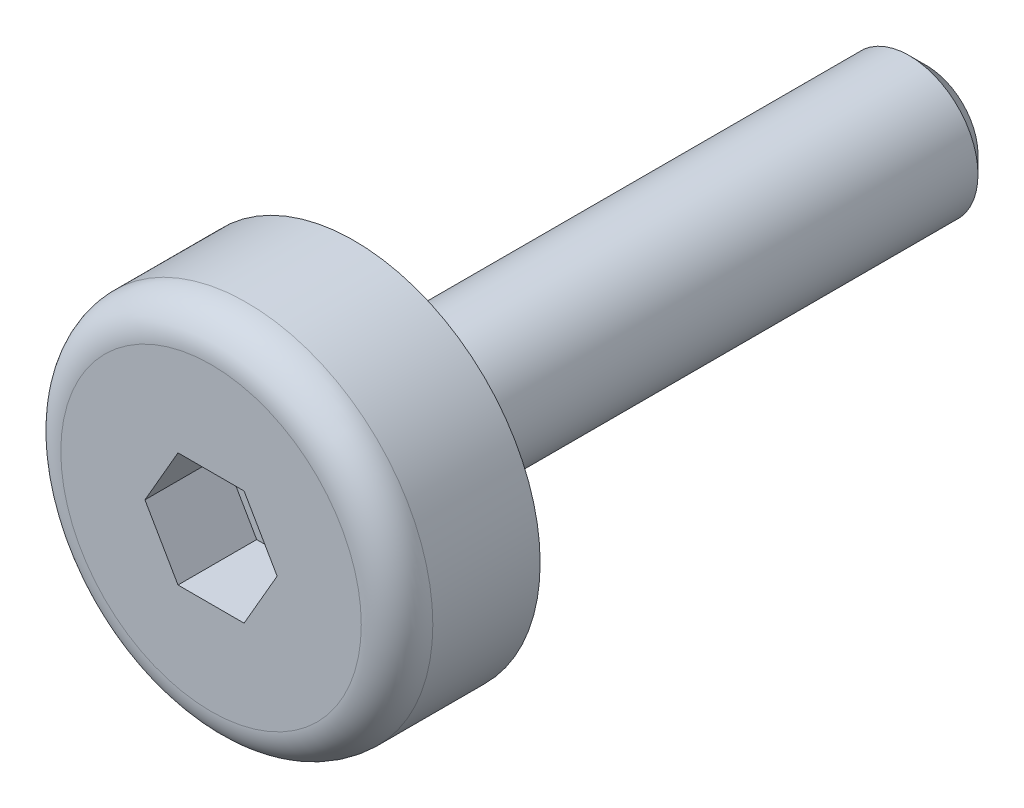
from build123d import *

# Parameters (mm, degrees)
SHANK_TIP_CHAMFER_SIZE = 0.3
PAN_HEAD_ROUND_R       = 0.625
HEX_DRIVE_CUT_DEPTH    = 1.375


with BuildPart() as part:
    # Screw Section → Screw Blank Revolve (revolve)
    with BuildSketch(Plane(origin=(0, 0, 0), x_dir=(1, 0, 0), z_dir=(0, 1, 0))):
        Polygon((0, 10), (1.2, 10), (1.2, 0), (3.25, 0), (3.25, -2.5), (0, -2.5), align=None)
    revolve(axis=Axis((0, 0, 10.123), (0, 0, -1)))

    # Shank Tip Chamfer
    shank_tip_chamfer_edges = [part.edges().sort_by_distance(p)[0] for p in [
        (-1.2, 0, -10),
    ]]
    chamfer(shank_tip_chamfer_edges, length=SHANK_TIP_CHAMFER_SIZE)

    # Pan Head Round
    pan_head_round_edges = [part.edges().sort_by_distance(p)[0] for p in [
        (-3.25, 0, 2.5),
    ]]
    fillet(pan_head_round_edges, radius=PAN_HEAD_ROUND_R)

    # Hex Drive Sketch → Hex Drive Cut (cut)
    with BuildSketch(Plane.XY.offset(2.5)):
        Polygon((1.154700538, 0), (0.577350269, 1), (-0.577350269, 1), (-1.154700538, 0), (-0.577350269, -1), (0.577350269, -1), align=None)
    extrude(amount=-HEX_DRIVE_CUT_DEPTH, mode=Mode.SUBTRACT)


solid = part.part
